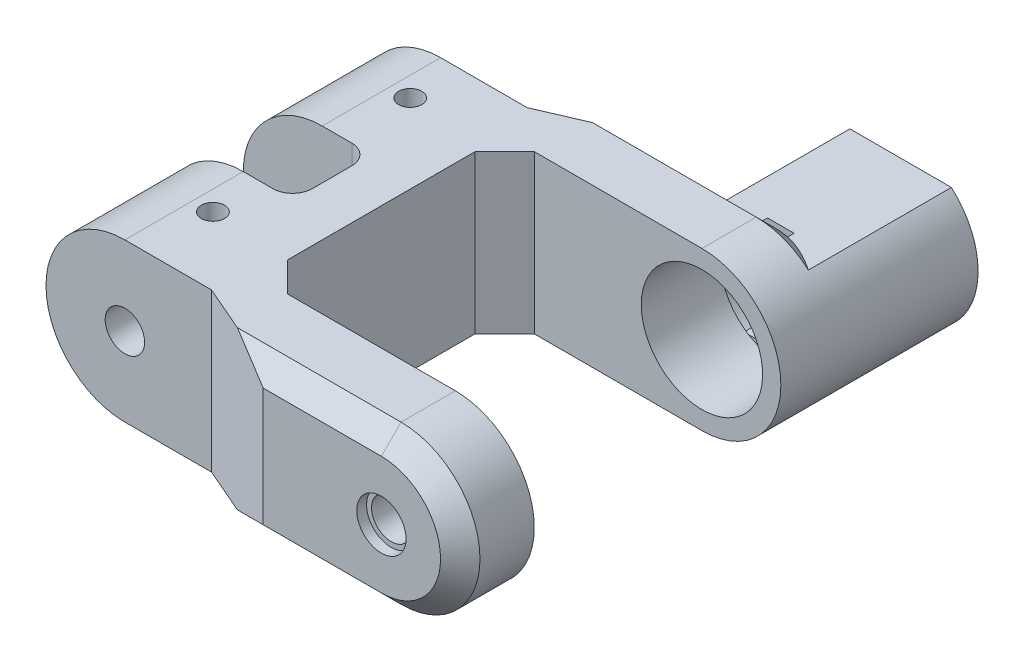
from build123d import *
from build123d.topology import SkipClean

# Parameters (mm, degrees)
CROQUIS1_R                 = 2
CROQUIS1_R_2               = 2.000000000000003
SALIENTE_EXTRUIR1_DEPTH    = 20
CORTAR_EXTRUIR1_DEPTH      = 44.68065933568311
CORTAR_EXTRUIR2_DEPTH      = 44.68065933568311
CORTAR_EXTRUIR2_DEPTH_BACK = 44.68065933568311
BOSS_EXTRUDE2_START        = -16
BOSS_EXTRUDE2_DEPTH        = 5
CHAFL_N1_SIZE              = 2
CHAFL_N2_SIZE              = 3
CORTAR_EXTRUIR3_DEPTH      = 46.12195091942049
CORTAR_EXTRUIR3_DEPTH_BACK = 46.12195091942049
CROQUIS4_W                 = 13
CROQUIS4_H                 = 8.000000000000007
BOSS_EXTRUDE1_START        = -12.5
SKETCH4_R                  = 2.000000000000003
BOSS_EXTRUDE1_DEPTH        = 20
CUT_EXTRUDE2_START         = -12.5
SKETCH6_R                  = 6.150000000000001
CUT_EXTRUDE2_DEPTH         = 8
CUT_EXTRUDE1_START         = -20.5
CUT_EXTRUDE1_DEPTH         = 32.38680424515073
CUT_EXTRUDE3_START         = 20
SKETCH7_R                  = 2.500000000000002
CUT_EXTRUDE3_DEPTH         = 1
CHAMFER2_SIZE              = 3
CUT_EXTRUDE4_DEPTH         = 52.88680424515073
CUT_EXTRUDE4_DEPTH_BACK    = 52.88680424515073
SKETCH9_R                  = 1.1750000000000003
FILLET1_R                  = 2


with BuildPart() as part:
    # Croquis1 → Saliente-Extruir1 (new, symmetric)
    with BuildSketch(Plane.XY):
        with BuildLine():
            Line((0, 8), (30, 8))
            ThreePointArc((30, 8), (38, 0), (30, -8))
            Line((30, -8), (0, -8))
            ThreePointArc((0, -8), (-8, 9.8e-16), (0, 8))
        make_face()
        Circle(CROQUIS1_R, mode=Mode.SUBTRACT)
        with Locations((30, 0)):
            Circle(CROQUIS1_R_2, mode=Mode.SUBTRACT)
    extrude(amount=SALIENTE_EXTRUIR1_DEPTH, both=True)

    # Croquis2 → Cortar-Extruir1 (cut, symmetric)
    with BuildSketch(Plane(origin=(0, 0, 0), x_dir=(1, 0, 0), z_dir=(0, 1, 0))):
        Polygon((-8, 16), (8.77460379211011, 16), (18.02448398763881, 20), (-8, 20), align=None)
    cortar_extruir1 = extrude(amount=CORTAR_EXTRUIR1_DEPTH, both=True, mode=Mode.SUBTRACT)

    # Simetría1: Cortar-Extruir1 across plane
    add(cortar_extruir1.mirror(Plane.XY), mode=Mode.SUBTRACT)

    # Croquis3 → Cortar-Extruir2 (cut, two sides: drawn at the far end of the back side and taken through both)
    with BuildSketch(Plane(origin=(0, 0, 0), x_dir=(1, 0, 0), z_dir=(0, 1, 0)).offset(-CORTAR_EXTRUIR2_DEPTH_BACK)):
        Polygon((49.99999999999999, -12.499999999999998), (9.999999999999998, -12.500000000000004), (9.999999999999998, 12.499999999999996), (49.99999999999999, 12.500000000000002), align=None)
    extrude(amount=CORTAR_EXTRUIR2_DEPTH + CORTAR_EXTRUIR2_DEPTH_BACK, mode=Mode.SUBTRACT)

    # Sketch8 → Boss-Extrude2 (add)
    with SkipClean():  # the faces are left unmerged after this step: merging them gives an invalid solid
        with BuildSketch(Plane.XY.offset(BOSS_EXTRUDE2_START)):
            with BuildLine():
                ThreePointArc((-3.7e-16, -2), (-0.5344767521565125, -1.9272609064172463), (-1.0300761498201043, -1.714334601404227))
                Line((-1.0300761498201039, -1.7143346014042276), (-7.918066759935976, -13.177876048443173))
                Line((-7.918066759935977, -13.177876048443173), (-6.789375757901606, -13.856062022616376))
                Line((-6.789375757901606, -13.856062022616376), (0, -8))
                Line((0, -8), (0, -2))
            make_face()
        extrude(amount=BOSS_EXTRUDE2_DEPTH)

    # Chaflán1
    chafl_n1_edges = [part.edges().sort_by_distance(p)[0] for p in [
        (38, -4e-16, 20),
        (24.012241993819405, 8, 20),
        (24.012241993819405, -8, -20),
        (24.012241993819405, 8, -20),
        (24.012241993819405, -8, 20),
        (38, -4e-16, -20),
    ]]
    chamfer(chafl_n1_edges, length=CHAFL_N1_SIZE)

    # Chaflán2
    chafl_n2_edges = [part.edges().sort_by_distance(p)[0] for p in [
        (9.999999999999998, 0, -12.499999999999996),
        (9.999999999999998, 0, 12.500000000000004),
    ]]
    chamfer(chafl_n2_edges, length=CHAFL_N2_SIZE)

    # Croquis4 → Cortar-Extruir3 (cut, two sides: drawn at the far end of the back side and taken through both)
    with SkipClean():  # the faces are left unmerged after this step: merging them gives an invalid solid
        with BuildSketch(Plane(origin=(0, 0, 0), x_dir=(1, 0, 0), z_dir=(0, 1, 0)).offset(-CORTAR_EXTRUIR3_DEPTH_BACK)):
            with Locations((-1.5, 0)):
                Rectangle(CROQUIS4_W, CROQUIS4_H)
        extrude(amount=CORTAR_EXTRUIR3_DEPTH + CORTAR_EXTRUIR3_DEPTH_BACK, mode=Mode.SUBTRACT)

    # Sketch4 → Boss-Extrude1 (add)
    with SkipClean():  # the faces are left unmerged after this step: merging them gives an invalid solid
        with BuildSketch(Plane.XY.offset(BOSS_EXTRUDE1_START)):
            with BuildLine():
                Line((22, 6.000000000000003), (22.000000000000004, -6.000000000000014))
                Line((22.000000000000004, -6.000000000000014), (35.291502622129165, -6.000000000000012))
                ThreePointArc((35.291502622129165, -6.000000000000012), (38, 4.44e-15), (35.29150262212916, 6.000000000000019))
                Line((35.29150262212916, 6.000000000000019), (22, 6.000000000000003))
            make_face()
            with Locations(Location((30, 0, 0), (0, 0, 180))):
                Circle(SKETCH4_R, mode=Mode.SUBTRACT)
        extrude(amount=-BOSS_EXTRUDE1_DEPTH)

    # Sketch6 → Cut-Extrude2 (cut)
    with SkipClean():  # the faces are left unmerged after this step: merging them gives an invalid solid
        with BuildSketch(Plane.XY.offset(CUT_EXTRUDE2_START)):
            with Locations(Location((30, 0, 0), (0, 0, 282.680383492))):
                Circle(SKETCH6_R)
        extrude(amount=-CUT_EXTRUDE2_DEPTH, mode=Mode.SUBTRACT)

    # Sketch5 → Cut-Extrude1 (cut, through all)
    with SkipClean():  # the faces are left unmerged after this step: merging them gives an invalid solid
        with BuildSketch(Plane.XY.offset(CUT_EXTRUDE1_START)):
            with BuildLine():
                Line((26.26904837876446, 5.2), (33.73095162123554, 5.2))
                ThreePointArc((33.73095162123554, 5.2), (36.400000000000006, 7.1e-16), (33.73095162123554, -5.199999999999998))
                Line((33.73095162123554, -5.199999999999998), (26.26904837876446, -5.2))
                ThreePointArc((26.26904837876446, -5.2), (23.59999999999999, 7.8e-16), (26.26904837876446, 5.2))
            make_face()
        extrude(amount=-CUT_EXTRUDE1_DEPTH, mode=Mode.SUBTRACT)

    # Sketch7 → Cut-Extrude3 (cut)
    with SkipClean():  # the faces are left unmerged after this step: merging them gives an invalid solid
        with BuildSketch(Plane.XY.offset(CUT_EXTRUDE3_START)):
            with Locations((30, 0)):
                Circle(SKETCH7_R)
        extrude(amount=-CUT_EXTRUDE3_DEPTH, mode=Mode.SUBTRACT)

    # Chamfer2
    chamfer2_edges = [part.edges().sort_by_distance(p)[0] for p in [
        (22.000000000000004, -6.000000000000014, -26.25),
        (22, 6.000000000000003, -26.25),
    ]]
    chamfer(chamfer2_edges, length=CHAMFER2_SIZE)

    # Sketch9 → Cut-Extrude4 (cut, two sides: drawn at the far end of the back side and taken through both)
    with BuildSketch(Plane(origin=(0, 0, 0), x_dir=(1, 0, 0), z_dir=(0, 1, 0)).offset(-CUT_EXTRUDE4_DEPTH_BACK)):
        with Locations(Location((2, 10.923187610000003, 0), (0, 0, 270))):
            Circle(SKETCH9_R)
        with Locations(Location((2, -9.076812389999997, 0), (0, 0, 270))):
            Circle(SKETCH9_R)
    extrude(amount=CUT_EXTRUDE4_DEPTH + CUT_EXTRUDE4_DEPTH_BACK, mode=Mode.SUBTRACT)

    # Fillet1
    fillet1_edges = [part.edges().sort_by_distance(p)[0] for p in [
        (5, 0, -4.0000000000000036),
        (5, 0, 4.0000000000000036),
    ]]
    fillet(fillet1_edges, radius=FILLET1_R)


solid = part.part
